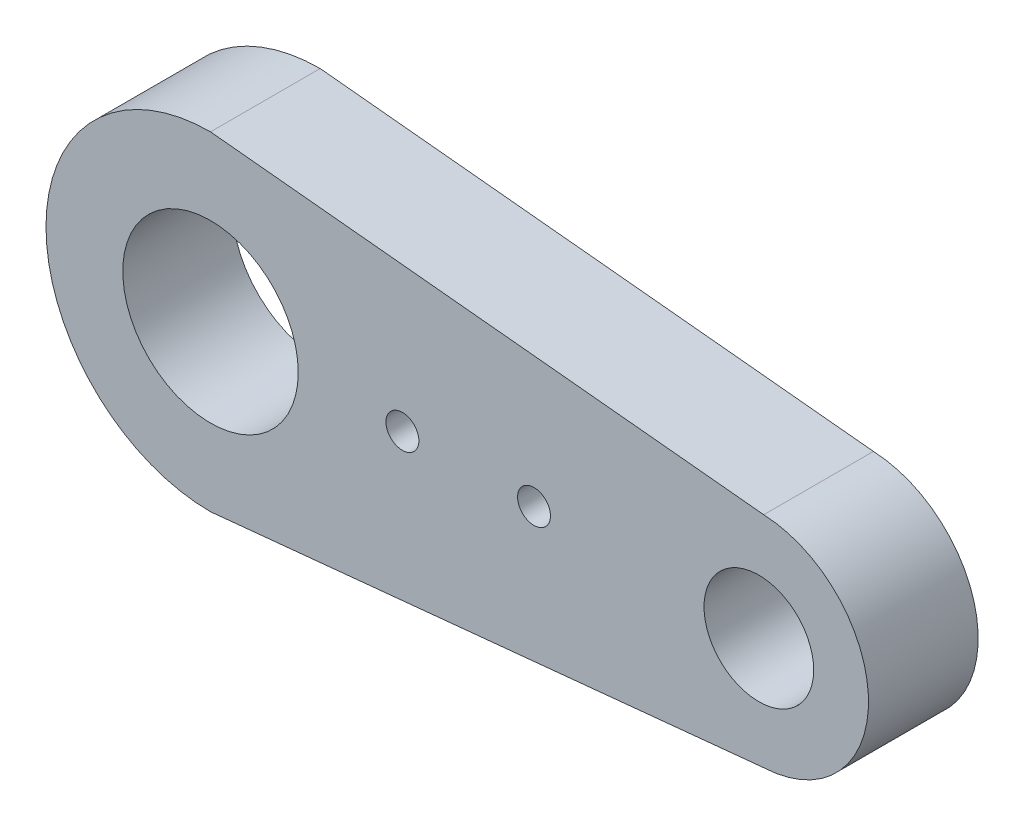
from build123d import *

# Parameters (mm, degrees)
SKETCH1_R           = 4
SKETCH1_R_2         = 2.5
BOSS_EXTRUDE1_DEPTH = 5
SKETCH2_R           = 0.75
CUT_EXTRUDE1_DEPTH  = 10


with BuildPart() as part:
    # Sketch1 → Boss-Extrude1 (new body)
    with BuildSketch(Plane.XY):
        with BuildLine():
            Line((-12.5, 6.822695454), (12.723447831, 4.317700065))
            ThreePointArc((12.723447831, 4.317700065), (17.5, -0.677304546), (12.723447831, -5.672309157))
            Line((12.723447831, -5.672309157), (-12.5, -8.177304546))
            ThreePointArc((-12.5, -8.177304546), (-20, -0.677304546), (-12.5, 6.822695454))
        make_face()
        with Locations((-12.5, -0.677304546)):
            Circle(SKETCH1_R, mode=Mode.SUBTRACT)
        with Locations((12.5, -0.677304546)):
            Circle(SKETCH1_R_2, mode=Mode.SUBTRACT)
    extrude(amount=BOSS_EXTRUDE1_DEPTH)

    # Sketch2 → Cut-Extrude1 (cut)
    with BuildSketch(Plane.XY.offset(5)):
        with Locations((-3.750139294, -0.627932239)):
            Circle(SKETCH2_R)
        with Locations((2.24976519, -0.594076942)):
            Circle(SKETCH2_R)
    extrude(amount=-CUT_EXTRUDE1_DEPTH, mode=Mode.SUBTRACT)


solid = part.part
